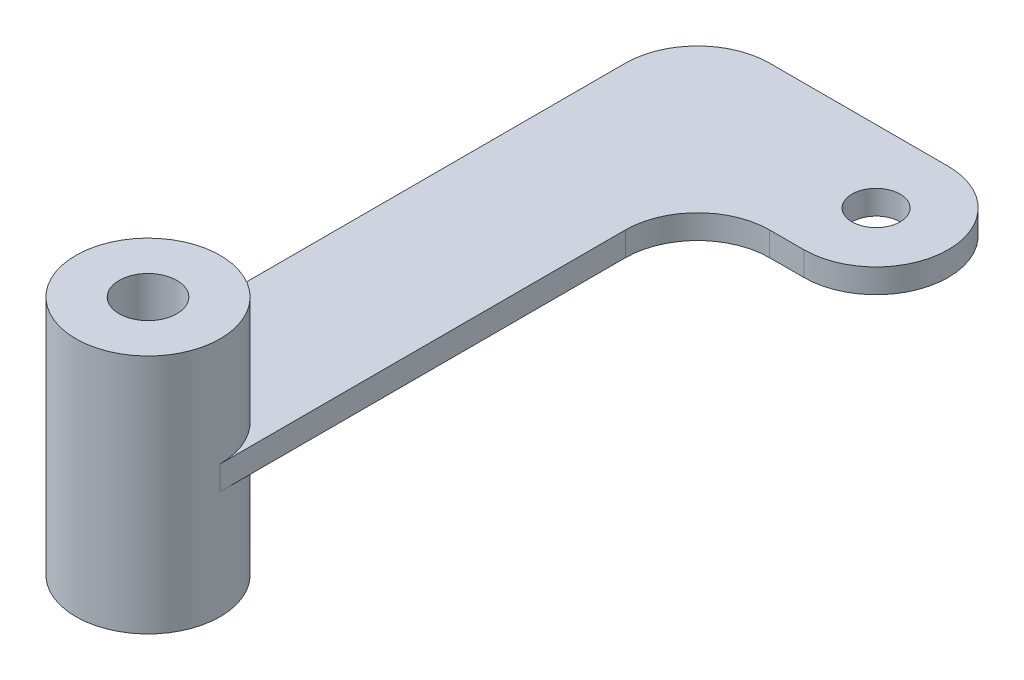
from build123d import *

# Parameters (mm, degrees)
SKETCH7_R           = 5
BOSS_EXTRUDE1_DEPTH = 2.5
FILLET3_R           = 15


with BuildPart() as part:
    # Sketch4 → Revolve1 (revolve)
    with BuildSketch(Plane.XY, mode=Mode.PRIVATE) as revolve1_sk:
        Polygon((5, 5), (5, -5), (6, -5), (6, -25), (15, -25), (15, 25), (6, 25), (6, 5), align=None)
    revolve(revolve1_sk.sketch.rotate(Axis((0, 25, 0), (0, -1, 0)), 90), axis=Axis((0, 25, 0), (0, -1, 0)))

    # Sketch7 → Boss-Extrude1 (add, symmetric)
    with BuildSketch(Plane(origin=(0, 0, 0), x_dir=(1, 0, 0), z_dir=(0, 1, 0))):
        with BuildLine():
            Line((-15, 129.126781955), (-15, 12.5))
            Line((-15, 12.5), (-8.291561976, 12.5))
            ThreePointArc((-8.291561976, 12.5), (-4.330127019, 14.361406616), (0, 15))
            ThreePointArc((0, 15), (10.606601718, 10.606601718), (15, 0))
            Line((15, 0), (15, 99.126781955))
            Line((15, 99.126781955), (37.082039325, 99.126781955))
            ThreePointArc((37.082039325, 99.126781955), (52.082039325, 114.126781955), (37.082039325, 129.126781955))
            Line((37.082039325, 129.126781955), (-15, 129.126781955))
        make_face()
        with Locations(Location((37.082039325, 114.126781955, 0), (0, 0, 270))):
            Circle(SKETCH7_R, mode=Mode.SUBTRACT)
    extrude(amount=BOSS_EXTRUDE1_DEPTH, both=True)

    # Fillet3
    fillet3_edges = [part.edges().sort_by_distance(p)[0] for p in [
        (15, 0, -99.126781955),
        (-15, 0, -129.126781955),
    ]]
    fillet(fillet3_edges, radius=FILLET3_R)


solid = part.part
